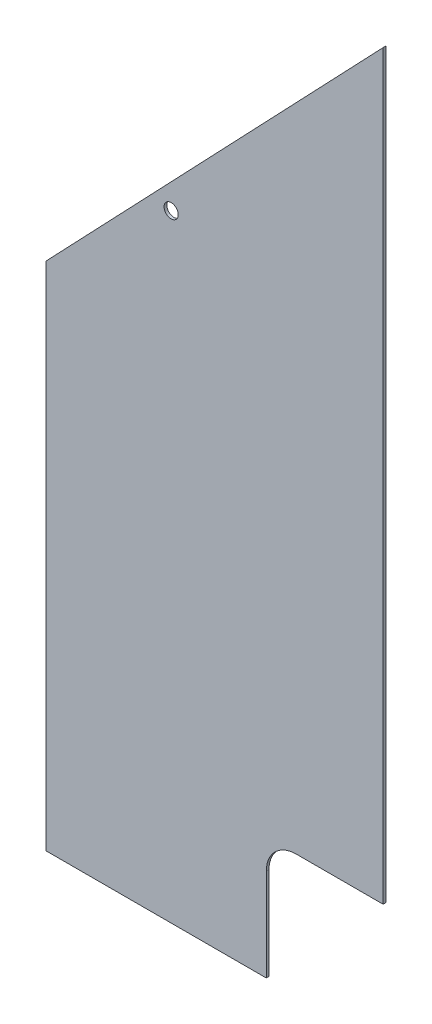
from build123d import *

# Parameters (mm, degrees)
BOSS_EXTRUDE1_DEPTH = 3.175
SKETCH5_R           = 8.255
CUT_EXTRUDE3_DEPTH  = 1084.698709571
CUT_EXTRUDE4_DEPTH  = 1084.698709571


with BuildPart() as part:
    # Sketch1 → Boss-Extrude1 (new body)
    with BuildSketch(Plane.XY):
        Polygon((0, 0), (-393.7, 0), (-393.7, 596.9), (0, 1009.65), align=None)
    extrude(amount=BOSS_EXTRUDE1_DEPTH)

    # Sketch5 → Cut-Extrude3 (cut, through all)
    with BuildSketch(Plane.XY.offset(3.175)):
        with Locations((-247.65, 720.725)):
            Circle(SKETCH5_R)
    extrude(amount=-CUT_EXTRUDE3_DEPTH, mode=Mode.SUBTRACT)

    # Sketch6 → Cut-Extrude4 (cut, through all)
    with BuildSketch(Plane.XY.offset(3.175)):
        with BuildLine():
            Line((0, 142.875), (-101.6, 142.875))
            ThreePointArc((-101.6, 142.875), (-126.295704333, 132.645704333), (-136.525, 107.95))
            Line((-136.525, 107.95), (-136.525, 0))
            Line((-136.525, 0), (0, 0))
            Line((0, 0), (0, 142.875))
        make_face()
    extrude(amount=-CUT_EXTRUDE4_DEPTH, mode=Mode.SUBTRACT)


solid = part.part
